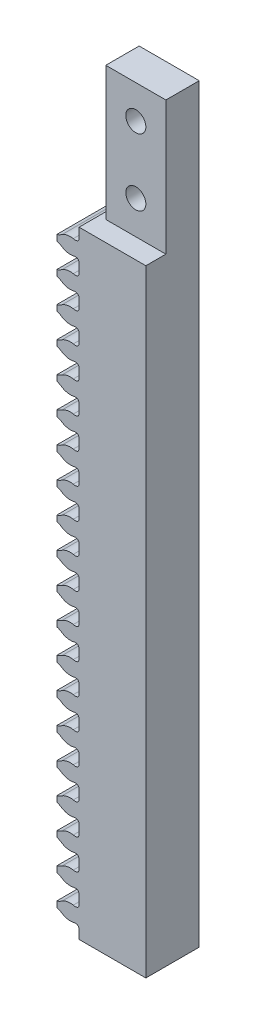
from build123d import *

# Parameters (mm, degrees)
BOSS_EXTRUDE1_DEPTH = 8
SKETCH3_W           = 9
SKETCH3_H           = 20
BOSS_EXTRUDE2_DEPTH = 5
SKETCH4_R           = 1.5
CUT_EXTRUDE2_DEPTH  = 5


with BuildPart() as part:
    # Sketch1 → Boss-Extrude1 (new body)
    with BuildSketch(Plane.XY):
        with BuildLine():
            Line((-6.863779761, 25.711863956), (-6.863779761, 24.199181272))
            ThreePointArc((-6.863779761, 24.199181272), (-6.936187649, 24.003510955), (-7.06589196, 23.840089515))
            ThreePointArc((-7.06589196, 23.840089515), (-7.39241362, 23.754122012), (-7.727171972, 23.798208872))
            ThreePointArc((-7.727171972, 23.798208872), (-8.593410509, 23.801056112), (-9.401298584, 23.488495449))
            ThreePointArc((-9.401298584, 23.488495449), (-9.786291081, 23.259660667), (-10.205012051, 23.100735117))
            Line((-10.205012051, 23.100735117), (-10.205012051, 22.680522614))
            Line((-10.205012051, 22.680522614), (-10.205012051, 22.260310111))
            ThreePointArc((-10.205012051, 22.260310111), (-9.786291081, 22.101384561), (-9.401298584, 21.872549779))
            ThreePointArc((-9.401298584, 21.872549779), (-8.593410509, 21.559989116), (-7.727171972, 21.562836356))
            ThreePointArc((-7.727171972, 21.562836356), (-7.39241362, 21.606923216), (-7.06589196, 21.520955712))
            ThreePointArc((-7.06589196, 21.520955712), (-6.936187649, 21.357534273), (-6.863779761, 21.161863956))
            Line((-6.863779761, 21.161863956), (-6.863779761, 19.649181272))
            ThreePointArc((-6.863779761, 19.649181272), (-6.936187649, 19.453510955), (-7.06589196, 19.290089515))
            ThreePointArc((-7.06589196, 19.290089515), (-7.39241362, 19.204122012), (-7.727171972, 19.248208872))
            ThreePointArc((-7.727171972, 19.248208872), (-8.593410509, 19.251056112), (-9.401298584, 18.938495449))
            ThreePointArc((-9.401298584, 18.938495449), (-9.786291081, 18.709660667), (-10.205012051, 18.550735117))
            Line((-10.205012051, 18.550735117), (-10.205012051, 18.130522614))
            Line((-10.205012051, 18.130522614), (-10.205012051, 17.710310111))
            ThreePointArc((-10.205012051, 17.710310111), (-9.786291081, 17.551384561), (-9.401298584, 17.322549779))
            ThreePointArc((-9.401298584, 17.322549779), (-8.593410509, 17.009989116), (-7.727171972, 17.012836356))
            ThreePointArc((-7.727171972, 17.012836356), (-7.39241362, 17.056923216), (-7.06589196, 16.970955712))
            ThreePointArc((-7.06589196, 16.970955712), (-6.936187649, 16.807534273), (-6.863779761, 16.611863956))
            Line((-6.863779761, 16.611863956), (-6.863779761, 15.22392857))
            Line((-6.863779761, 15.22392857), (-2.643575946, 15.22392857))
            Line((-2.643575946, 15.22392857), (3.136220239, 15.22392857))
            Line((3.136220239, 15.22392857), (3.136220239, 107.611863956))
            Line((3.136220239, 107.611863956), (-6.863779761, 107.611863956))
            Line((-6.863779761, 107.611863956), (-6.863779761, 106.099181272))
            ThreePointArc((-6.863779761, 106.099181272), (-6.936187649, 105.903510955), (-7.06589196, 105.740089515))
            ThreePointArc((-7.06589196, 105.740089515), (-7.39241362, 105.654122012), (-7.727171972, 105.698208872))
            ThreePointArc((-7.727171972, 105.698208872), (-8.593410509, 105.701056112), (-9.401298584, 105.388495449))
            ThreePointArc((-9.401298584, 105.388495449), (-9.786291081, 105.159660667), (-10.205012051, 105.000735117))
            Line((-10.205012051, 105.000735117), (-10.205012051, 104.580522614))
            Line((-10.205012051, 104.580522614), (-10.205012051, 104.160310111))
            ThreePointArc((-10.205012051, 104.160310111), (-9.786291081, 104.001384561), (-9.401298584, 103.772549779))
            ThreePointArc((-9.401298584, 103.772549779), (-8.593410509, 103.459989116), (-7.727171972, 103.462836356))
            ThreePointArc((-7.727171972, 103.462836356), (-7.39241362, 103.506923216), (-7.06589196, 103.420955712))
            ThreePointArc((-7.06589196, 103.420955712), (-6.936187649, 103.257534273), (-6.863779761, 103.061863956))
            Line((-6.863779761, 103.061863956), (-6.863779761, 101.549181272))
            ThreePointArc((-6.863779761, 101.549181272), (-6.936187649, 101.353510955), (-7.06589196, 101.190089515))
            ThreePointArc((-7.06589196, 101.190089515), (-7.39241362, 101.104122012), (-7.727171972, 101.148208872))
            ThreePointArc((-7.727171972, 101.148208872), (-8.593410509, 101.151056112), (-9.401298584, 100.838495449))
            ThreePointArc((-9.401298584, 100.838495449), (-9.786291081, 100.609660667), (-10.205012051, 100.450735117))
            Line((-10.205012051, 100.450735117), (-10.205012051, 100.030522614))
            Line((-10.205012051, 100.030522614), (-10.205012051, 99.610310111))
            ThreePointArc((-10.205012051, 99.610310111), (-9.786291081, 99.451384561), (-9.401298584, 99.222549779))
            ThreePointArc((-9.401298584, 99.222549779), (-8.593410509, 98.909989116), (-7.727171972, 98.912836356))
            ThreePointArc((-7.727171972, 98.912836356), (-7.39241362, 98.956923216), (-7.06589196, 98.870955712))
            ThreePointArc((-7.06589196, 98.870955712), (-6.936187649, 98.707534273), (-6.863779761, 98.511863956))
            Line((-6.863779761, 98.511863956), (-6.863779761, 96.999181272))
            ThreePointArc((-6.863779761, 96.999181272), (-6.936187649, 96.803510955), (-7.06589196, 96.640089515))
            ThreePointArc((-7.06589196, 96.640089515), (-7.39241362, 96.554122012), (-7.727171972, 96.598208872))
            ThreePointArc((-7.727171972, 96.598208872), (-8.593410509, 96.601056112), (-9.401298584, 96.288495449))
            ThreePointArc((-9.401298584, 96.288495449), (-9.786291081, 96.059660667), (-10.205012051, 95.900735117))
            Line((-10.205012051, 95.900735117), (-10.205012051, 95.480522614))
            Line((-10.205012051, 95.480522614), (-10.205012051, 95.060310111))
            ThreePointArc((-10.205012051, 95.060310111), (-9.786291081, 94.901384561), (-9.401298584, 94.672549779))
            ThreePointArc((-9.401298584, 94.672549779), (-8.593410509, 94.359989116), (-7.727171972, 94.362836356))
            ThreePointArc((-7.727171972, 94.362836356), (-7.39241362, 94.406923216), (-7.06589196, 94.320955712))
            ThreePointArc((-7.06589196, 94.320955712), (-6.936187649, 94.157534273), (-6.863779761, 93.961863956))
            Line((-6.863779761, 93.961863956), (-6.863779761, 92.449181272))
            ThreePointArc((-6.863779761, 92.449181272), (-6.936187649, 92.253510955), (-7.06589196, 92.090089515))
            ThreePointArc((-7.06589196, 92.090089515), (-7.39241362, 92.004122012), (-7.727171972, 92.048208872))
            ThreePointArc((-7.727171972, 92.048208872), (-8.593410509, 92.051056112), (-9.401298584, 91.738495449))
            ThreePointArc((-9.401298584, 91.738495449), (-9.786291081, 91.509660667), (-10.205012051, 91.350735117))
            Line((-10.205012051, 91.350735117), (-10.205012051, 90.930522614))
            Line((-10.205012051, 90.930522614), (-10.205012051, 90.510310111))
            ThreePointArc((-10.205012051, 90.510310111), (-9.786291081, 90.351384561), (-9.401298584, 90.122549779))
            ThreePointArc((-9.401298584, 90.122549779), (-8.593410509, 89.809989116), (-7.727171972, 89.812836356))
            ThreePointArc((-7.727171972, 89.812836356), (-7.39241362, 89.856923216), (-7.06589196, 89.770955712))
            ThreePointArc((-7.06589196, 89.770955712), (-6.936187649, 89.607534273), (-6.863779761, 89.411863956))
            Line((-6.863779761, 89.411863956), (-6.863779761, 87.899181272))
            ThreePointArc((-6.863779761, 87.899181272), (-6.936187649, 87.703510955), (-7.06589196, 87.540089515))
            ThreePointArc((-7.06589196, 87.540089515), (-7.39241362, 87.454122012), (-7.727171972, 87.498208872))
            ThreePointArc((-7.727171972, 87.498208872), (-8.593410509, 87.501056112), (-9.401298584, 87.188495449))
            ThreePointArc((-9.401298584, 87.188495449), (-9.786291081, 86.959660667), (-10.205012051, 86.800735117))
            Line((-10.205012051, 86.800735117), (-10.205012051, 86.380522614))
            Line((-10.205012051, 86.380522614), (-10.205012051, 85.960310111))
            ThreePointArc((-10.205012051, 85.960310111), (-9.786291081, 85.801384561), (-9.401298584, 85.572549779))
            ThreePointArc((-9.401298584, 85.572549779), (-8.593410509, 85.259989116), (-7.727171972, 85.262836356))
            ThreePointArc((-7.727171972, 85.262836356), (-7.39241362, 85.306923216), (-7.06589196, 85.220955712))
            ThreePointArc((-7.06589196, 85.220955712), (-6.936187649, 85.057534273), (-6.863779761, 84.861863956))
            Line((-6.863779761, 84.861863956), (-6.863779761, 83.349181272))
            ThreePointArc((-6.863779761, 83.349181272), (-6.936187649, 83.153510955), (-7.06589196, 82.990089515))
            ThreePointArc((-7.06589196, 82.990089515), (-7.39241362, 82.904122012), (-7.727171972, 82.948208872))
            ThreePointArc((-7.727171972, 82.948208872), (-8.593410509, 82.951056112), (-9.401298584, 82.638495449))
            ThreePointArc((-9.401298584, 82.638495449), (-9.786291081, 82.409660667), (-10.205012051, 82.250735117))
            Line((-10.205012051, 82.250735117), (-10.205012051, 81.830522614))
            Line((-10.205012051, 81.830522614), (-10.205012051, 81.410310111))
            ThreePointArc((-10.205012051, 81.410310111), (-9.786291081, 81.251384561), (-9.401298584, 81.022549779))
            ThreePointArc((-9.401298584, 81.022549779), (-8.593410509, 80.709989116), (-7.727171972, 80.712836356))
            ThreePointArc((-7.727171972, 80.712836356), (-7.39241362, 80.756923216), (-7.06589196, 80.670955712))
            ThreePointArc((-7.06589196, 80.670955712), (-6.936187649, 80.507534273), (-6.863779761, 80.311863956))
            Line((-6.863779761, 80.311863956), (-6.863779761, 78.799181272))
            ThreePointArc((-6.863779761, 78.799181272), (-6.936187649, 78.603510955), (-7.06589196, 78.440089515))
            ThreePointArc((-7.06589196, 78.440089515), (-7.39241362, 78.354122012), (-7.727171972, 78.398208872))
            ThreePointArc((-7.727171972, 78.398208872), (-8.593410509, 78.401056112), (-9.401298584, 78.088495449))
            ThreePointArc((-9.401298584, 78.088495449), (-9.786291081, 77.859660667), (-10.205012051, 77.700735117))
            Line((-10.205012051, 77.700735117), (-10.205012051, 77.280522614))
            Line((-10.205012051, 77.280522614), (-10.205012051, 76.860310111))
            ThreePointArc((-10.205012051, 76.860310111), (-9.786291081, 76.701384561), (-9.401298584, 76.472549779))
            ThreePointArc((-9.401298584, 76.472549779), (-8.593410509, 76.159989116), (-7.727171972, 76.162836356))
            ThreePointArc((-7.727171972, 76.162836356), (-7.39241362, 76.206923216), (-7.06589196, 76.120955712))
            ThreePointArc((-7.06589196, 76.120955712), (-6.936187649, 75.957534273), (-6.863779761, 75.761863956))
            Line((-6.863779761, 75.761863956), (-6.863779761, 74.249181272))
            ThreePointArc((-6.863779761, 74.249181272), (-6.936187649, 74.053510955), (-7.06589196, 73.890089515))
            ThreePointArc((-7.06589196, 73.890089515), (-7.39241362, 73.804122012), (-7.727171972, 73.848208872))
            ThreePointArc((-7.727171972, 73.848208872), (-8.593410509, 73.851056112), (-9.401298584, 73.538495449))
            ThreePointArc((-9.401298584, 73.538495449), (-9.786291081, 73.309660667), (-10.205012051, 73.150735117))
            Line((-10.205012051, 73.150735117), (-10.205012051, 72.730522614))
            Line((-10.205012051, 72.730522614), (-10.205012051, 72.310310111))
            ThreePointArc((-10.205012051, 72.310310111), (-9.786291081, 72.151384561), (-9.401298584, 71.922549779))
            ThreePointArc((-9.401298584, 71.922549779), (-8.593410509, 71.609989116), (-7.727171972, 71.612836356))
            ThreePointArc((-7.727171972, 71.612836356), (-7.39241362, 71.656923216), (-7.06589196, 71.570955712))
            ThreePointArc((-7.06589196, 71.570955712), (-6.936187649, 71.407534273), (-6.863779761, 71.211863956))
            Line((-6.863779761, 71.211863956), (-6.863779761, 69.699181272))
            ThreePointArc((-6.863779761, 69.699181272), (-6.936187649, 69.503510955), (-7.06589196, 69.340089515))
            ThreePointArc((-7.06589196, 69.340089515), (-7.39241362, 69.254122012), (-7.727171972, 69.298208872))
            ThreePointArc((-7.727171972, 69.298208872), (-8.593410509, 69.301056112), (-9.401298584, 68.988495449))
            ThreePointArc((-9.401298584, 68.988495449), (-9.786291081, 68.759660667), (-10.205012051, 68.600735117))
            Line((-10.205012051, 68.600735117), (-10.205012051, 68.180522614))
            Line((-10.205012051, 68.180522614), (-10.205012051, 67.760310111))
            ThreePointArc((-10.205012051, 67.760310111), (-9.786291081, 67.601384561), (-9.401298584, 67.372549779))
            ThreePointArc((-9.401298584, 67.372549779), (-8.593410509, 67.059989116), (-7.727171972, 67.062836356))
            ThreePointArc((-7.727171972, 67.062836356), (-7.39241362, 67.106923216), (-7.06589196, 67.020955712))
            ThreePointArc((-7.06589196, 67.020955712), (-6.936187649, 66.857534273), (-6.863779761, 66.661863956))
            Line((-6.863779761, 66.661863956), (-6.863779761, 65.149181272))
            ThreePointArc((-6.863779761, 65.149181272), (-6.936187649, 64.953510955), (-7.06589196, 64.790089515))
            ThreePointArc((-7.06589196, 64.790089515), (-7.39241362, 64.704122012), (-7.727171972, 64.748208872))
            ThreePointArc((-7.727171972, 64.748208872), (-8.593410509, 64.751056112), (-9.401298584, 64.438495449))
            ThreePointArc((-9.401298584, 64.438495449), (-9.786291081, 64.209660667), (-10.205012051, 64.050735117))
            Line((-10.205012051, 64.050735117), (-10.205012051, 63.630522614))
            Line((-10.205012051, 63.630522614), (-10.205012051, 63.210310111))
            ThreePointArc((-10.205012051, 63.210310111), (-9.786291081, 63.051384561), (-9.401298584, 62.822549779))
            ThreePointArc((-9.401298584, 62.822549779), (-8.593410509, 62.509989116), (-7.727171972, 62.512836356))
            ThreePointArc((-7.727171972, 62.512836356), (-7.39241362, 62.556923216), (-7.06589196, 62.470955712))
            ThreePointArc((-7.06589196, 62.470955712), (-6.936187649, 62.307534273), (-6.863779761, 62.111863956))
            Line((-6.863779761, 62.111863956), (-6.863779761, 60.599181272))
            ThreePointArc((-6.863779761, 60.599181272), (-6.936187649, 60.403510955), (-7.06589196, 60.240089515))
            ThreePointArc((-7.06589196, 60.240089515), (-7.39241362, 60.154122012), (-7.727171972, 60.198208872))
            ThreePointArc((-7.727171972, 60.198208872), (-8.593410509, 60.201056112), (-9.401298584, 59.888495449))
            ThreePointArc((-9.401298584, 59.888495449), (-9.786291081, 59.659660667), (-10.205012051, 59.500735117))
            Line((-10.205012051, 59.500735117), (-10.205012051, 59.080522614))
            Line((-10.205012051, 59.080522614), (-10.205012051, 58.660310111))
            ThreePointArc((-10.205012051, 58.660310111), (-9.786291081, 58.501384561), (-9.401298584, 58.272549779))
            ThreePointArc((-9.401298584, 58.272549779), (-8.593410509, 57.959989116), (-7.727171972, 57.962836356))
            ThreePointArc((-7.727171972, 57.962836356), (-7.39241362, 58.006923216), (-7.06589196, 57.920955712))
            ThreePointArc((-7.06589196, 57.920955712), (-6.936187649, 57.757534273), (-6.863779761, 57.561863956))
            Line((-6.863779761, 57.561863956), (-6.863779761, 56.049181272))
            ThreePointArc((-6.863779761, 56.049181272), (-6.936187649, 55.853510955), (-7.06589196, 55.690089515))
            ThreePointArc((-7.06589196, 55.690089515), (-7.39241362, 55.604122012), (-7.727171972, 55.648208872))
            ThreePointArc((-7.727171972, 55.648208872), (-8.593410509, 55.651056112), (-9.401298584, 55.338495449))
            ThreePointArc((-9.401298584, 55.338495449), (-9.786291081, 55.109660667), (-10.205012051, 54.950735117))
            Line((-10.205012051, 54.950735117), (-10.205012051, 54.530522614))
            Line((-10.205012051, 54.530522614), (-10.205012051, 54.110310111))
            ThreePointArc((-10.205012051, 54.110310111), (-9.786291081, 53.951384561), (-9.401298584, 53.722549779))
            ThreePointArc((-9.401298584, 53.722549779), (-8.593410509, 53.409989116), (-7.727171972, 53.412836356))
            ThreePointArc((-7.727171972, 53.412836356), (-7.39241362, 53.456923216), (-7.06589196, 53.370955712))
            ThreePointArc((-7.06589196, 53.370955712), (-6.936187649, 53.207534273), (-6.863779761, 53.011863956))
            Line((-6.863779761, 53.011863956), (-6.863779761, 51.499181272))
            ThreePointArc((-6.863779761, 51.499181272), (-6.936187649, 51.303510955), (-7.06589196, 51.140089515))
            ThreePointArc((-7.06589196, 51.140089515), (-7.39241362, 51.054122012), (-7.727171972, 51.098208872))
            ThreePointArc((-7.727171972, 51.098208872), (-8.593410509, 51.101056112), (-9.401298584, 50.788495449))
            ThreePointArc((-9.401298584, 50.788495449), (-9.786291081, 50.559660667), (-10.205012051, 50.400735117))
            Line((-10.205012051, 50.400735117), (-10.205012051, 49.980522614))
            Line((-10.205012051, 49.980522614), (-10.205012051, 49.560310111))
            ThreePointArc((-10.205012051, 49.560310111), (-9.786291081, 49.401384561), (-9.401298584, 49.172549779))
            ThreePointArc((-9.401298584, 49.172549779), (-8.593410509, 48.859989116), (-7.727171972, 48.862836356))
            ThreePointArc((-7.727171972, 48.862836356), (-7.39241362, 48.906923216), (-7.06589196, 48.820955712))
            ThreePointArc((-7.06589196, 48.820955712), (-6.936187649, 48.657534273), (-6.863779761, 48.461863956))
            Line((-6.863779761, 48.461863956), (-6.863779761, 46.949181272))
            ThreePointArc((-6.863779761, 46.949181272), (-6.936187649, 46.753510955), (-7.06589196, 46.590089515))
            ThreePointArc((-7.06589196, 46.590089515), (-7.39241362, 46.504122012), (-7.727171972, 46.548208872))
            ThreePointArc((-7.727171972, 46.548208872), (-8.593410509, 46.551056112), (-9.401298584, 46.238495449))
            ThreePointArc((-9.401298584, 46.238495449), (-9.786291081, 46.009660667), (-10.205012051, 45.850735117))
            Line((-10.205012051, 45.850735117), (-10.205012051, 45.430522614))
            Line((-10.205012051, 45.430522614), (-10.205012051, 45.010310111))
            ThreePointArc((-10.205012051, 45.010310111), (-9.786291081, 44.851384561), (-9.401298584, 44.622549779))
            ThreePointArc((-9.401298584, 44.622549779), (-8.593410509, 44.309989116), (-7.727171972, 44.312836356))
            ThreePointArc((-7.727171972, 44.312836356), (-7.39241362, 44.356923216), (-7.06589196, 44.270955712))
            ThreePointArc((-7.06589196, 44.270955712), (-6.936187649, 44.107534273), (-6.863779761, 43.911863956))
            Line((-6.863779761, 43.911863956), (-6.863779761, 42.399181272))
            ThreePointArc((-6.863779761, 42.399181272), (-6.936187649, 42.203510955), (-7.06589196, 42.040089515))
            ThreePointArc((-7.06589196, 42.040089515), (-7.39241362, 41.954122012), (-7.727171972, 41.998208872))
            ThreePointArc((-7.727171972, 41.998208872), (-8.593410509, 42.001056112), (-9.401298584, 41.688495449))
            ThreePointArc((-9.401298584, 41.688495449), (-9.786291081, 41.459660667), (-10.205012051, 41.300735117))
            Line((-10.205012051, 41.300735117), (-10.205012051, 40.880522614))
            Line((-10.205012051, 40.880522614), (-10.205012051, 40.460310111))
            ThreePointArc((-10.205012051, 40.460310111), (-9.786291081, 40.301384561), (-9.401298584, 40.072549779))
            ThreePointArc((-9.401298584, 40.072549779), (-8.593410509, 39.759989116), (-7.727171972, 39.762836356))
            ThreePointArc((-7.727171972, 39.762836356), (-7.39241362, 39.806923216), (-7.06589196, 39.720955712))
            ThreePointArc((-7.06589196, 39.720955712), (-6.936187649, 39.557534273), (-6.863779761, 39.361863956))
            Line((-6.863779761, 39.361863956), (-6.863779761, 37.849181272))
            ThreePointArc((-6.863779761, 37.849181272), (-6.936187649, 37.653510955), (-7.06589196, 37.490089515))
            ThreePointArc((-7.06589196, 37.490089515), (-7.39241362, 37.404122012), (-7.727171972, 37.448208872))
            ThreePointArc((-7.727171972, 37.448208872), (-8.593410509, 37.451056112), (-9.401298584, 37.138495449))
            ThreePointArc((-9.401298584, 37.138495449), (-9.786291081, 36.909660667), (-10.205012051, 36.750735117))
            Line((-10.205012051, 36.750735117), (-10.205012051, 36.330522614))
            Line((-10.205012051, 36.330522614), (-10.205012051, 35.910310111))
            ThreePointArc((-10.205012051, 35.910310111), (-9.786291081, 35.751384561), (-9.401298584, 35.522549779))
            ThreePointArc((-9.401298584, 35.522549779), (-8.593410509, 35.209989116), (-7.727171972, 35.212836356))
            ThreePointArc((-7.727171972, 35.212836356), (-7.39241362, 35.256923216), (-7.06589196, 35.170955712))
            ThreePointArc((-7.06589196, 35.170955712), (-6.936187649, 35.007534273), (-6.863779761, 34.811863956))
            Line((-6.863779761, 34.811863956), (-6.863779761, 33.299181272))
            ThreePointArc((-6.863779761, 33.299181272), (-6.936187649, 33.103510955), (-7.06589196, 32.940089515))
            ThreePointArc((-7.06589196, 32.940089515), (-7.39241362, 32.854122012), (-7.727171972, 32.898208872))
            ThreePointArc((-7.727171972, 32.898208872), (-8.593410509, 32.901056112), (-9.401298584, 32.588495449))
            ThreePointArc((-9.401298584, 32.588495449), (-9.786291081, 32.359660667), (-10.205012051, 32.200735117))
            Line((-10.205012051, 32.200735117), (-10.205012051, 31.780522614))
            Line((-10.205012051, 31.780522614), (-10.205012051, 31.360310111))
            ThreePointArc((-10.205012051, 31.360310111), (-9.786291081, 31.201384561), (-9.401298584, 30.972549779))
            ThreePointArc((-9.401298584, 30.972549779), (-8.593410509, 30.659989116), (-7.727171972, 30.662836356))
            ThreePointArc((-7.727171972, 30.662836356), (-7.39241362, 30.706923216), (-7.06589196, 30.620955712))
            ThreePointArc((-7.06589196, 30.620955712), (-6.936187649, 30.457534273), (-6.863779761, 30.261863956))
            Line((-6.863779761, 30.261863956), (-6.863779761, 28.749181272))
            ThreePointArc((-6.863779761, 28.749181272), (-6.936187649, 28.553510955), (-7.06589196, 28.390089515))
            ThreePointArc((-7.06589196, 28.390089515), (-7.39241362, 28.304122012), (-7.727171972, 28.348208872))
            ThreePointArc((-7.727171972, 28.348208872), (-8.593410509, 28.351056112), (-9.401298584, 28.038495449))
            ThreePointArc((-9.401298584, 28.038495449), (-9.786291081, 27.809660667), (-10.205012051, 27.650735117))
            Line((-10.205012051, 27.650735117), (-10.205012051, 27.230522614))
            Line((-10.205012051, 27.230522614), (-10.205012051, 26.810310111))
            ThreePointArc((-10.205012051, 26.810310111), (-9.786291081, 26.651384561), (-9.401298584, 26.422549779))
            ThreePointArc((-9.401298584, 26.422549779), (-8.593410509, 26.109989116), (-7.727171972, 26.112836356))
            ThreePointArc((-7.727171972, 26.112836356), (-7.39241362, 26.156923216), (-7.06589196, 26.070955712))
            ThreePointArc((-7.06589196, 26.070955712), (-6.936187649, 25.907534273), (-6.863779761, 25.711863956))
        make_face()
    extrude(amount=BOSS_EXTRUDE1_DEPTH)

    # Sketch3 → Boss-Extrude2 (add)
    with BuildSketch(Plane(origin=(0, 0, 0), x_dir=(-1, 0, 0), z_dir=(0, 0, -1))):
        with Locations((1.363779761, 117.611863956)):
            Rectangle(SKETCH3_W, SKETCH3_H)
    extrude(amount=-BOSS_EXTRUDE2_DEPTH)

    # Sketch4 → Cut-Extrude2 (cut)
    with BuildSketch(Plane.XY.offset(5)):
        with Locations((-1.363779761, 122.611863956)):
            Circle(SKETCH4_R)
        with Locations((-1.363779761, 112.611863956)):
            Circle(SKETCH4_R)
    extrude(amount=-CUT_EXTRUDE2_DEPTH, mode=Mode.SUBTRACT)


solid = part.part
